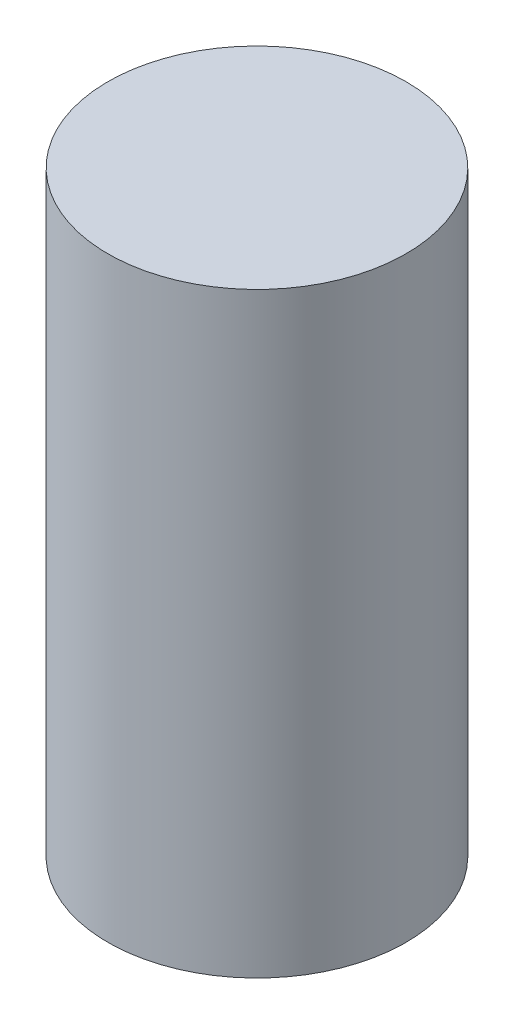
from build123d import *

# Parameters (mm, degrees)
SKETCH1_R           = 14.5
BOSS_EXTRUDE1_DEPTH = 58


with BuildPart() as part:
    # Sketch1 → Boss-Extrude1 (new body)
    with BuildSketch(Plane(origin=(0, 0, 0), x_dir=(1, 0, 0), z_dir=(0, 1, 0))):
        with Locations(Location((0, 0, 0), (0, 0, 90))):
            Circle(SKETCH1_R)
    extrude(amount=BOSS_EXTRUDE1_DEPTH)


solid = part.part
